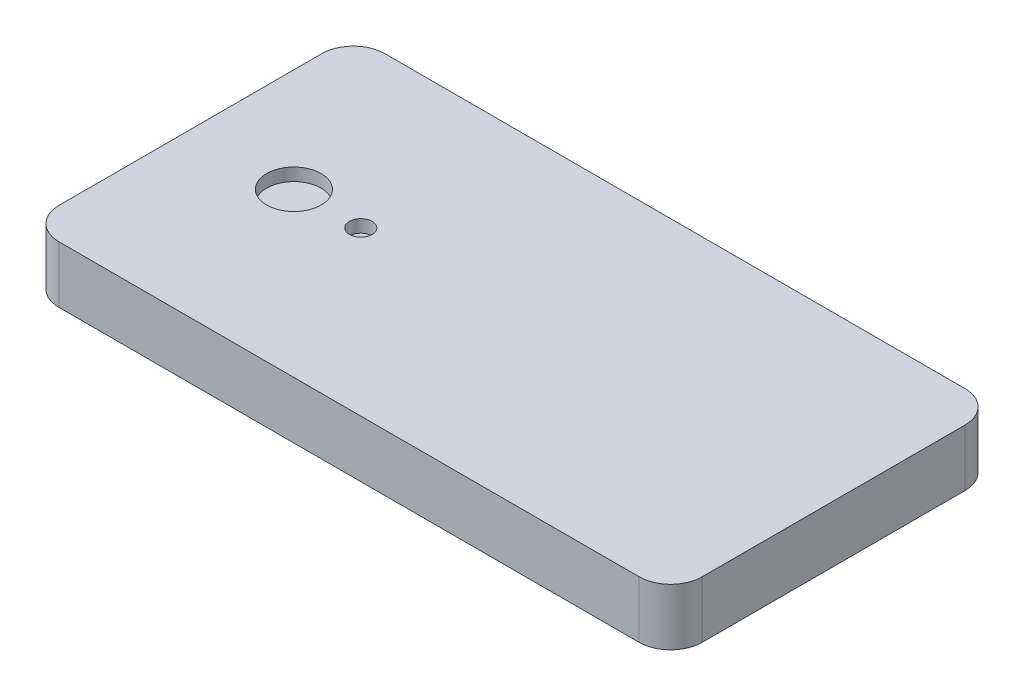
from build123d import *

# Parameters (mm, degrees)
SKETCH1_W           = 129.4384
SKETCH1_H           = 65.5828
BOSS_EXTRUDE1_DEPTH = 11.43
FILLET1_R           = 6.35
SKETCH2_R           = 5.4864
SKETCH2_R_2         = 2.286
CUT_EXTRUDE1_DEPTH  = 2.54


with BuildPart() as part:
    # Sketch1 → Boss-Extrude1 (new body)
    with BuildSketch(Plane(origin=(0, 0, 0), x_dir=(1, 0, 0), z_dir=(0, 1, 0))):
        with Locations((58.984295801, -30.062138363)):
            Rectangle(SKETCH1_W, SKETCH1_H)
    extrude(amount=BOSS_EXTRUDE1_DEPTH)

    # Fillet1
    fillet1_edges = [part.edges().sort_by_distance(p)[0] for p in [
        (-5.734904199, 5.715, -2.729261637),
        (123.703495801, 5.715, -2.729261637),
        (123.703495801, 5.715, 62.853538363),
        (-5.734904199, 5.715, 62.853538363),
    ]]
    fillet(fillet1_edges, radius=FILLET1_R)

    # Sketch2 → Cut-Extrude1 (cut)
    with BuildSketch(Plane(origin=(0, 11.43, 0), x_dir=(1, 0, 0), z_dir=(0, 1, 0))):
        with Locations(Location((15.093095801, -30.062138363, 0), (0, 0, 270))):
            Circle(SKETCH2_R)
        with Locations(Location((28.555095801, -30.062138363, 0), (0, 0, 270))):
            Circle(SKETCH2_R_2)
    extrude(amount=-CUT_EXTRUDE1_DEPTH, mode=Mode.SUBTRACT)


solid = part.part
